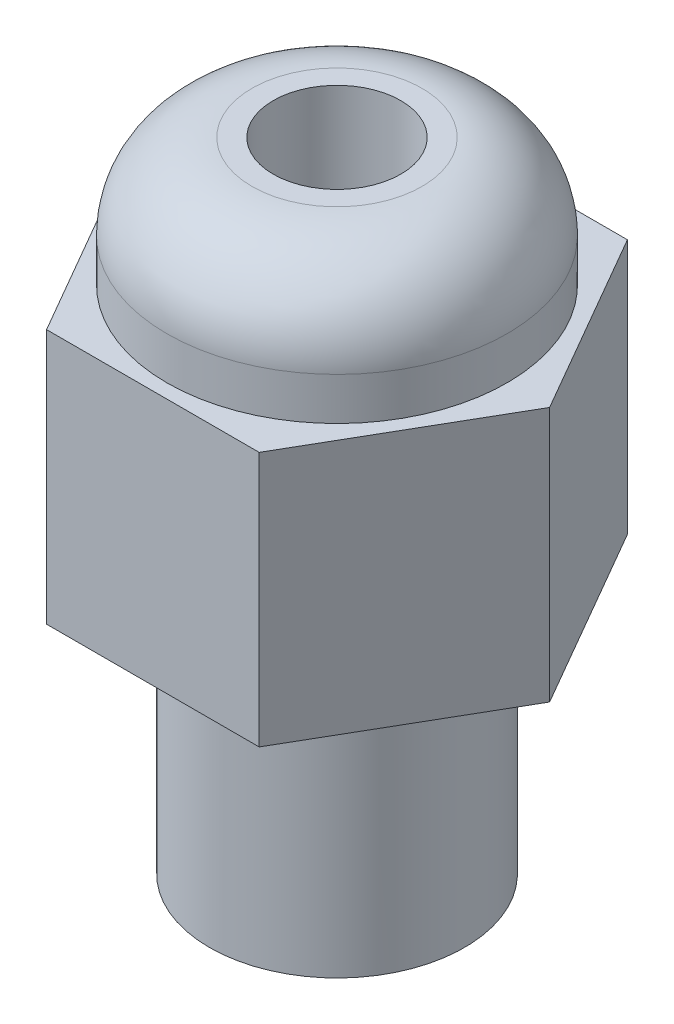
from build123d import *
from build123d.topology import SkipClean

# Parameters (mm, degrees)
SKETCH2_R           = 1.5
BOSS_EXTRUDE1_DEPTH = 6
SKETCH3_R           = 4
SKETCH3_R_2         = 1.5
BOSS_EXTRUDE2_DEPTH = 3
FILLET1_R           = 2
BOSS_EXTRUDE3_START = 6
SKETCH4_R           = 3
SKETCH4_R_2         = 1.5
BOSS_EXTRUDE3_DEPTH = 6


with BuildPart() as part:
    # Sketch2 → Boss-Extrude1 (new body)
    with BuildSketch(Plane(origin=(0, 0, 0), x_dir=(1, 0, 0), z_dir=(0, 1, 0))):
        Polygon((5, 0), (2.5, 4.330127019), (-2.5, 4.330127019), (-5, 0), (-2.5, -4.330127019), (2.5, -4.330127019), align=None)
        with Locations(Location((0, 0, 0), (0, 0, 270))):
            Circle(SKETCH2_R, mode=Mode.SUBTRACT)
    extrude(amount=BOSS_EXTRUDE1_DEPTH)

    # Sketch3 → Boss-Extrude2 (add)
    with BuildSketch(Plane(origin=(0, 6, 0), x_dir=(1, 0, 0), z_dir=(0, 1, 0))):
        with Locations(Location((0, 0, 0), (0, 0, 270))):
            Circle(SKETCH3_R)
        with Locations(Location((0, 0, 0), (0, 0, 270))):
            Circle(SKETCH3_R_2, mode=Mode.SUBTRACT)
    extrude(amount=BOSS_EXTRUDE2_DEPTH)

    # Fillet1
    fillet1_edges = [part.edges().sort_by_distance(p)[0] for p in [
        (0, 9, -4),
    ]]
    fillet(fillet1_edges, radius=FILLET1_R)

    # Sketch4 → Boss-Extrude3 (add)
    with SkipClean():  # the faces are left unmerged after this step: merging them gives an invalid solid
        with BuildSketch(Plane.XZ.offset(BOSS_EXTRUDE3_START)):
            with Locations(Location((0, 0, 0), (0, 0, 90))):
                Circle(SKETCH4_R)
            with Locations(Location((0, 0, 0), (0, 0, 270))):
                Circle(SKETCH4_R_2, mode=Mode.SUBTRACT)
        extrude(amount=-BOSS_EXTRUDE3_DEPTH)


solid = part.part
